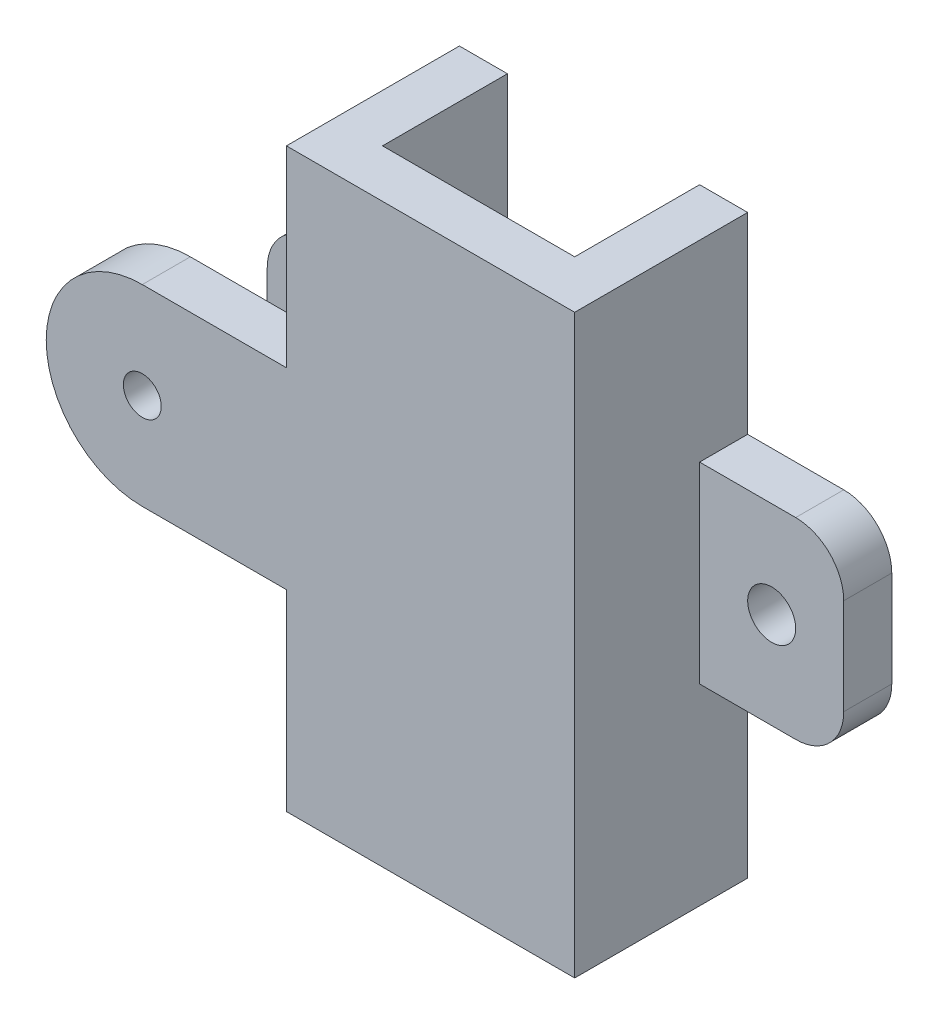
from build123d import *

# Parameters (mm, degrees)
BOSS_EXTRUDE1_DEPTH = 76.2
SKETCH3_R           = 2.5019
BOSS_EXTRUDE2_DEPTH = 6.35
SKETCH4_W           = 19.05
SKETCH4_H           = 25.4
SKETCH4_R           = 3.175
BOSS_EXTRUDE3_DEPTH = 6.35
FILLET1_R           = 6.35


with BuildPart() as part:
    # Sketch2 → Boss-Extrude1 (new body)
    with BuildSketch(Plane(origin=(0, 0, 0), x_dir=(1, 0, 0), z_dir=(0, 1, 0))):
        Polygon((0, 22.86), (0, 0), (38.1, 0), (38.1, 22.86), (31.75, 22.86), (31.75, 6.35), (6.35, 6.35), (6.35, 22.86), align=None)
    extrude(amount=BOSS_EXTRUDE1_DEPTH)

    # Sketch3 → Boss-Extrude2 (add)
    with BuildSketch(Plane.XY):
        with BuildLine():
            Line((19.05, 50.8), (-19.05, 50.8))
            ThreePointArc((-19.05, 50.8), (-31.75, 38.1), (-19.05, 25.4))
            Line((-19.05, 25.4), (19.05, 25.4))
            ThreePointArc((19.05, 25.4), (31.75, 38.1), (19.05, 50.8))
        make_face()
        with Locations((-19.05, 38.1)):
            Circle(SKETCH3_R, mode=Mode.SUBTRACT)
    extrude(amount=-BOSS_EXTRUDE2_DEPTH)

    # Sketch4 → Boss-Extrude3 (add)
    # profile 1 of 2: a face of its own
    with BuildSketch(Plane(origin=(0, 0, -22.86), x_dir=(-1, 0, 0), z_dir=(0, 0, -1))):
        with Locations((-47.625, 38.1)):
            Rectangle(SKETCH4_W, SKETCH4_H)
        with Locations((-47.625, 38.1)):
            Circle(SKETCH4_R, mode=Mode.SUBTRACT)
    # profile 2 of 2: a face of its own
    with BuildSketch(Plane(origin=(0, 0, -22.86), x_dir=(-1, 0, 0), z_dir=(0, 0, -1))):
        with Locations((9.525, 38.1)):
            Rectangle(SKETCH4_W, SKETCH4_H)
        with Locations(Location((9.525, 38.1, 0), (0, 0, 180))):
            Circle(SKETCH4_R, mode=Mode.SUBTRACT)
    extrude(amount=-BOSS_EXTRUDE3_DEPTH)

    # Fillet1
    fillet1_edges = [part.edges().sort_by_distance(p)[0] for p in [
        (57.15, 25.4, -19.685),
        (57.15, 50.8, -19.685),
        (-19.05, 50.8, -19.685),
        (-19.05, 25.4, -19.685),
    ]]
    fillet(fillet1_edges, radius=FILLET1_R)


solid = part.part
